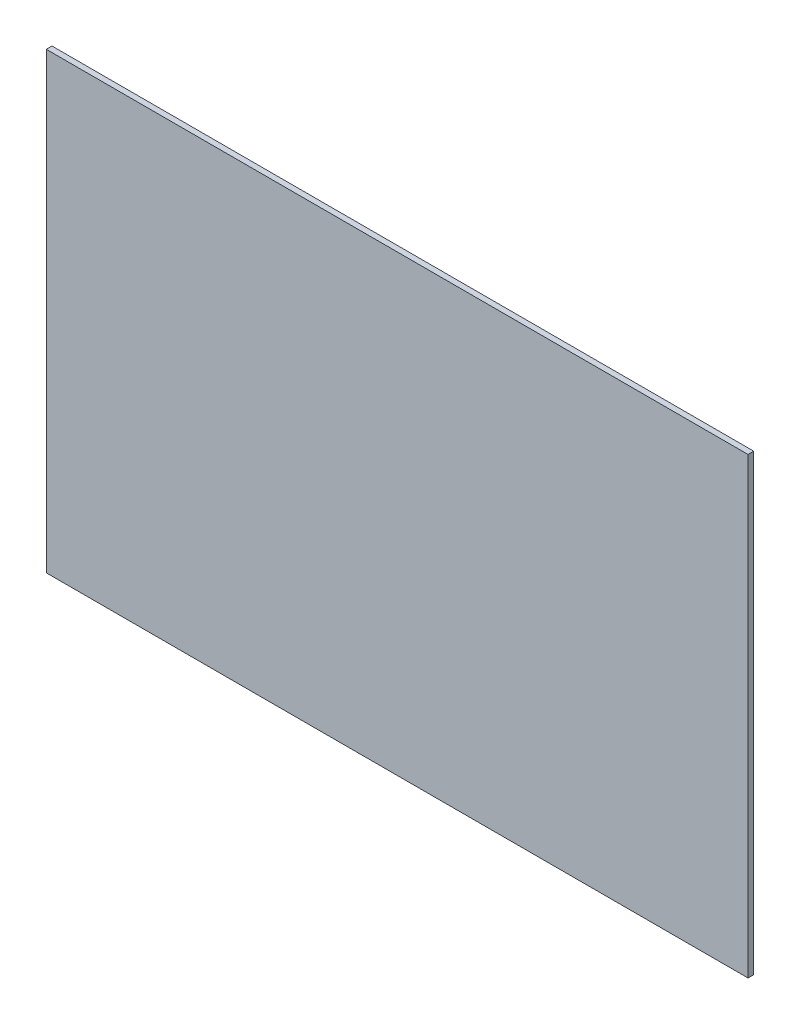
from build123d import *

# Parameters (mm, degrees)
ESQUISSE1_W        = 799.7
ESQUISSE1_H        = 516.7
BOSS_EXTRU_1_DEPTH = 6.5


with BuildPart() as part:
    # Esquisse1 → Boss.-Extru.1 (new body)
    with BuildSketch(Plane.XY):
        Rectangle(ESQUISSE1_W, ESQUISSE1_H)
    extrude(amount=BOSS_EXTRU_1_DEPTH)


solid = part.part
